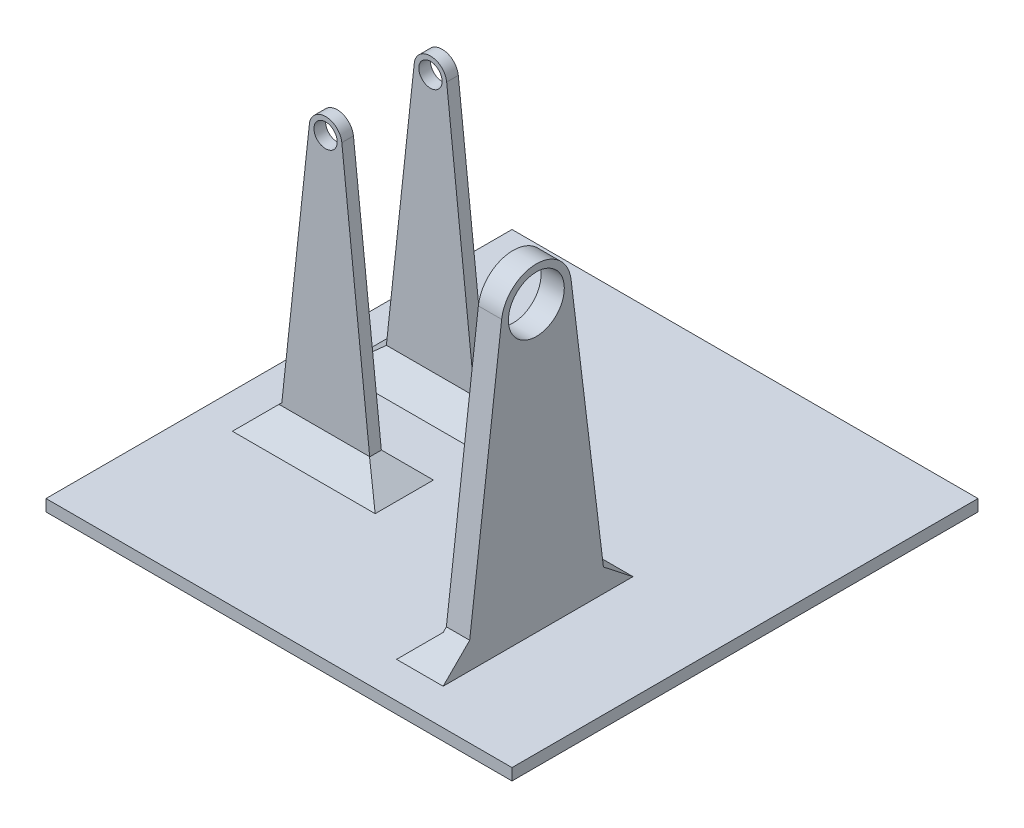
from build123d import *
from OCP.BRepFilletAPI import BRepFilletAPI_MakeChamfer

# Parameters (mm, degrees)
SKETCH_2_W               = 240.549430728
SKETCH_2_H               = 149.540933388
EXTRUDE_1_DEPTH          = 5
SKETCH_6_W               = 93.246571425
SKETCH_6_H               = 149.540933388
EXTRUDE_4_DEPTH          = 5
SKETCH_8_W               = 274.716709757
SKETCH_8_H               = 58.51354913
EXTRUDE_6_DEPTH          = 5
CUT_EXTRUDE_2_DEPTH      = 252.755772101
CUT_EXTRUDE_2_DEPTH_BACK = 252.755772101
SKETCH_9_W               = 59.079292396
SKETCH_9_H               = 149.540933388
SKETCH_10_W              = 104.703380117
SKETCH_10_H              = 208.054482518
CUT_EXTRUDE_3_DEPTH      = 10
SKETCH_12_W              = 200
SKETCH_12_H              = 200
EXTRUDE_7_DEPTH          = 5
SKETCH_13_OUTSIDE_W      = 259.728
SKETCH_13_OUTSIDE_H      = 267.782
SKETCH_13_OUTSIDE_W_2    = 200
SKETCH_13_OUTSIDE_H_2    = 200
CUT_EXTRUDE_4_DEPTH      = 278.64321362
EXTRUDE_START            = -75
SKETCH_18_R              = 5
EXTRUDE_9_DEPTH          = 5
EXTRUDE_START_2          = -45
SKETCH_16_R              = 12
EXTRUDE_10_DEPTH         = 10
CHAMFER_1_SIZE           = 10
CHAMFER_1_SIZE2          = 11.275873044
CHAMFER_1_SIZE2_2        = 11.474527449
CHAMFER_2_SIZE           = 10


with BuildPart() as part:
    # 草图2 → 凸台-拉伸1 (new body)
    with BuildSketch(Plane(origin=(0, 0, 0), x_dir=(1, 0, 0), z_dir=(0, 1, 0))):
        Rectangle(SKETCH_2_W, SKETCH_2_H)
    extrude(amount=EXTRUDE_1_DEPTH)

    # 草图6 → 凸台-拉伸4 (add)
    with BuildSketch(Plane(origin=(0, 5, 0), x_dir=(1, 0, 0), z_dir=(0, 1, 0))):
        with Locations((166.898001077, 0)):
            Rectangle(SKETCH_6_W, SKETCH_6_H)
    extrude(amount=-EXTRUDE_4_DEPTH)

    # 草图8 → 凸台-拉伸6 (add)
    with BuildSketch(Plane(origin=(0, 5, 0), x_dir=(1, 0, 0), z_dir=(0, 1, 0))):
        with Locations((76.162931911, -104.027241259)):
            Rectangle(SKETCH_8_W, SKETCH_8_H)
    extrude(amount=-EXTRUDE_6_DEPTH)

    # 草图9 → 切除-拉伸2 (cut, two sides: drawn at the far end of the back side and taken through both)
    with BuildSketch(Plane(origin=(0, 5, 0), x_dir=(1, 0, 0), z_dir=(0, 1, 0)).offset(-CUT_EXTRUDE_2_DEPTH_BACK)):
        with Locations((-90.735069166, 0)):
            Rectangle(SKETCH_9_W, SKETCH_9_H)
    extrude(amount=CUT_EXTRUDE_2_DEPTH + CUT_EXTRUDE_2_DEPTH_BACK, mode=Mode.SUBTRACT)

    # 草图10 → 切除-拉伸3 (cut)
    with BuildSketch(Plane(origin=(0, 5, 0), x_dir=(1, 0, 0), z_dir=(0, 1, 0))):
        with Locations((-8.84373291, -29.256774565)):
            Rectangle(SKETCH_10_W, SKETCH_10_H)
    extrude(amount=-CUT_EXTRUDE_3_DEPTH, mode=Mode.SUBTRACT)

    # 草图12 → 凸台-拉伸7 (add)
    with BuildSketch(Plane(origin=(0, 5, 0), x_dir=(1, 0, 0), z_dir=(0, 1, 0))):
        with Locations((143.507957149, -25.229533306)):
            Rectangle(SKETCH_12_W, SKETCH_12_H)
    extrude(amount=-EXTRUDE_7_DEPTH)

    # 草图13 outside → 切除-拉伸4 (cut, through all)
    with BuildSketch(Plane(origin=(0, 5, 0), x_dir=(1, 0, 0), z_dir=(0, 1, 0))):
        with Locations((143.508, -29.257)):
            Rectangle(SKETCH_13_OUTSIDE_W, SKETCH_13_OUTSIDE_H)
        with Locations((143.507957149, -25.229533306)):
            Rectangle(SKETCH_13_OUTSIDE_W_2, SKETCH_13_OUTSIDE_H_2, mode=Mode.SUBTRACT)
    extrude(amount=-CUT_EXTRUDE_4_DEPTH, mode=Mode.SUBTRACT)

    # 草图18 → 凸台-拉伸9 (add)
    with BuildSketch(Plane.XY.offset(125.229533306).offset(EXTRUDE_START)):
        with BuildLine():
            Line((108.507957149, 5), (95.467491183, 125.751589006))
            ThreePointArc((95.467491183, 125.751589006), (88.507957149, 132), (81.548423116, 125.751589006))
            Line((81.548423116, 125.751589006), (68.507957149, 5))
            Line((68.507957149, 5), (108.507957149, 5))
        make_face()
        with Locations((88.507957149, 125)):
            Circle(SKETCH_18_R, mode=Mode.SUBTRACT)
    extrude_9 = extrude(amount=-EXTRUDE_9_DEPTH)

    # 镜向1: 凸台-拉伸9 across plane
    add(extrude_9.mirror(Plane.XY.offset(25.229533306)))

    # 草图16 → 凸台-拉伸10 (add)
    with BuildSketch(Plane(origin=(243.507957149, 0, 0), x_dir=(0, 0, -1), z_dir=(1, 0, 0)).offset(EXTRUDE_START_2)):
        with BuildLine():
            Line((-39.779533306, 5), (-54.890001581, 128.817097965))
            ThreePointArc((-54.890001581, 128.817097965), (-69.779533306, 142), (-84.669065031, 128.817097965))
            Line((-84.669065031, 128.817097965), (-99.779533306, 5))
            Line((-99.779533306, 5), (-39.779533306, 5))
        make_face()
        with Locations((-69.779533306, 127)):
            Circle(SKETCH_16_R, mode=Mode.SUBTRACT)
    extrude(amount=-EXTRUDE_10_DEPTH)

    # 倒角1: one chamfer whose edges measure the first distance from different faces: ONE call of the kernel's chamfer builder (chamfer() names one face for all edges)
    chamfer_1_edges_1 = [part.edges().sort_by_distance(p)[0] for p in [
        (88.507957149, 5, 50.229533306),
        (88.507957149, 5, 45.229533306),
        (88.507957149, 5, 5.229533306),
        (88.507957149, 5, 0.229533306),
    ]]
    chamfer_1_edges_2 = [part.edges().sort_by_distance(p)[0] for p in [
        (108.507957149, 5, 47.729533306),
    ]]
    chamfer_1_side_2 = [part.faces().sort_by_distance(p)[0] for p in [
        (101.987724166, 65.375794503, 47.729533306),
    ]]
    chamfer_1_edges_3 = [part.edges().sort_by_distance(p)[0] for p in [
        (68.507957149, 5, 47.729533306),
        (108.507957149, 5, 2.729533306),
    ]]
    chamfer_1_side_3 = [part.faces().sort_by_distance(p)[0] for p in [
        (143.302828944, 5, 24.544148691),
    ]]
    chamfer_1_edges_4 = [part.edges().sort_by_distance(p)[0] for p in [
        (68.507957149, 5, 2.729533306),
    ]]
    chamfer_1_side_4 = [part.faces().sort_by_distance(p)[0] for p in [
        (75.028190132, 65.375794503, 2.729533306),
    ]]
    chamfer_1_edges_5 = [part.edges().sort_by_distance(p)[0] for p in [
        (193.507957149, 5, 39.779533306),
    ]]
    chamfer_1_side_5 = [part.faces().sort_by_distance(p)[0] for p in [
        (193.507957149, 66.908548983, 47.334767443),
    ]]
    chamfer_1_edges_6 = [part.edges().sort_by_distance(p)[0] for p in [
        (193.507957149, 5, 99.779533306),
    ]]
    chamfer_1_side_6 = [part.faces().sort_by_distance(p)[0] for p in [
        (143.302828944, 5, 24.544148691),
    ]]
    chamfer_1 = BRepFilletAPI_MakeChamfer(part.part.solid().wrapped)
    for e in chamfer_1_edges_1:
        chamfer_1.Add(CHAMFER_1_SIZE, e.wrapped)
    for e in chamfer_1_edges_2:
        chamfer_1.Add(CHAMFER_1_SIZE, CHAMFER_1_SIZE2, e.wrapped, chamfer_1_side_2[0].wrapped)  # the first distance lies on this face
    for e in chamfer_1_edges_3:
        chamfer_1.Add(CHAMFER_1_SIZE, CHAMFER_1_SIZE2, e.wrapped, chamfer_1_side_3[0].wrapped)  # the first distance lies on this face
    for e in chamfer_1_edges_4:
        chamfer_1.Add(CHAMFER_1_SIZE, CHAMFER_1_SIZE2, e.wrapped, chamfer_1_side_4[0].wrapped)  # the first distance lies on this face
    for e in chamfer_1_edges_5:
        chamfer_1.Add(CHAMFER_1_SIZE, CHAMFER_1_SIZE2_2, e.wrapped, chamfer_1_side_5[0].wrapped)  # the first distance lies on this face
    for e in chamfer_1_edges_6:
        chamfer_1.Add(CHAMFER_1_SIZE, CHAMFER_1_SIZE2_2, e.wrapped, chamfer_1_side_6[0].wrapped)  # the first distance lies on this face
    add(Compound.cast(chamfer_1.Shape()), mode=Mode.REPLACE)

    # 倒角2
    chamfer_2_edges = [part.edges().sort_by_distance(p)[0] for p in [
        (188.507957149, 5, 69.042269581),
    ]]
    chamfer(chamfer_2_edges, length=CHAMFER_2_SIZE)


solid = part.part
